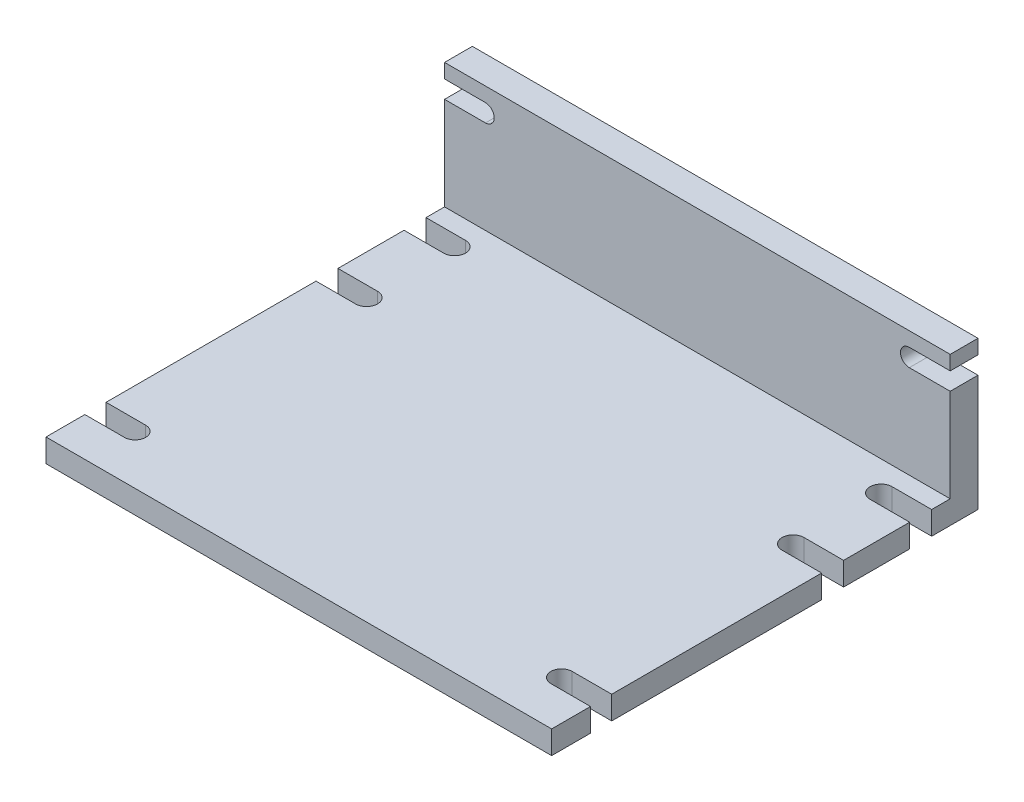
from build123d import *

# Parameters (mm, degrees)
CROQUIS1_W              = 109.11
CROQUIS1_H              = 92
SALIENTE_EXTRUIR1_DEPTH = 32
CROQUIS2_W              = 86
CROQUIS2_H              = 27
CORTAR_EXTRUIR1_DEPTH   = 123.658029089
CORTAR_EXTRUIR2_DEPTH   = 107.753210842
CORTAR_EXTRUIR4_DEPTH   = 77.297103648


with BuildPart() as part:
    # Croquis1 → Saliente-Extruir1 (new body)
    with BuildSketch(Plane(origin=(0, 0, 0), x_dir=(1, 0, 0), z_dir=(0, 1, 0))):
        Rectangle(CROQUIS1_W, CROQUIS1_H)
    extrude(amount=SALIENTE_EXTRUIR1_DEPTH)

    # Croquis2 → Cortar-Extruir1 (cut, through all)
    with BuildSketch(Plane(origin=(54.555, 0, 0), x_dir=(0, 0, -1), z_dir=(1, 0, 0))):
        with Locations((-3, 18.5)):
            Rectangle(CROQUIS2_W, CROQUIS2_H)
    extrude(amount=-CORTAR_EXTRUIR1_DEPTH, mode=Mode.SUBTRACT)

    # Croquis3 → Cortar-Extruir2 (cut, through all)
    with BuildSketch(Plane.XY.offset(-40)):
        with BuildLine():
            Line((45.735, 28.9), (54.555, 28.9))
            Line((54.555, 28.9), (54.555, 25.1))
            Line((54.555, 25.1), (45.735, 25.1))
            ThreePointArc((45.735, 25.1), (43.835, 27), (45.735, 28.9))
        make_face()
        with BuildLine():
            Line((-45.735, 28.9), (-54.555, 28.9))
            Line((-54.555, 28.9), (-54.555, 25.1))
            Line((-54.555, 25.1), (-45.735, 25.1))
            ThreePointArc((-45.735, 25.1), (-43.835, 27), (-45.735, 28.9))
        make_face()
    extrude(amount=-CORTAR_EXTRUIR2_DEPTH, mode=Mode.SUBTRACT)

    # Croquis4 → Cortar-Extruir4 (cut, through all)
    with BuildSketch(Plane(origin=(0, 5, 0), x_dir=(1, 0, 0), z_dir=(0, 1, 0))):
        with BuildLine():
            Line((-46.015, 36), (-54.555, 36))
            Line((-54.555, 36), (-54.555, 31.26))
            Line((-54.555, 31.26), (-46.015, 31.26))
            ThreePointArc((-46.015, 31.26), (-43.645, 33.63), (-46.015, 36))
        make_face()
        with BuildLine():
            Line((-46.015, 17), (-54.555, 17))
            Line((-54.555, 17), (-54.555, 12.26))
            Line((-54.555, 12.26), (-46.015, 12.26))
            ThreePointArc((-46.015, 12.26), (-43.645, 14.63), (-46.015, 17))
        make_face()
        with BuildLine():
            Line((-46.015, -33.037861791), (-54.555, -33.037861791))
            Line((-54.555, -33.037861791), (-54.555, -37.615607647))
            Line((-54.555, -37.615607647), (-46.015, -37.615607647))
            ThreePointArc((-46.015, -37.615607647), (-43.726127072, -35.326734719), (-46.015, -33.037861791))
        make_face()
        with BuildLine():
            Line((54.555, -37.615607647), (46.015, -37.615607647))
            ThreePointArc((46.015, -37.615607647), (43.726127072, -35.326734719), (46.015, -33.037861791))
            Line((46.015, -33.037861791), (54.555, -33.037861791))
            Line((54.555, -33.037861791), (54.555, -37.615607647))
        make_face()
        with BuildLine():
            Line((54.555, 17), (54.555, 12.26))
            Line((54.555, 12.26), (46.015, 12.26))
            ThreePointArc((46.015, 12.26), (43.645, 14.63), (46.015, 17))
            Line((46.015, 17), (54.555, 17))
        make_face()
        with BuildLine():
            Line((54.555, 31.26), (46.015, 31.26))
            ThreePointArc((46.015, 31.26), (43.645, 33.63), (46.015, 36))
            Line((46.015, 36), (54.555, 36))
            Line((54.555, 36), (54.555, 31.26))
        make_face()
    extrude(amount=-CORTAR_EXTRUIR4_DEPTH, mode=Mode.SUBTRACT)


solid = part.part
